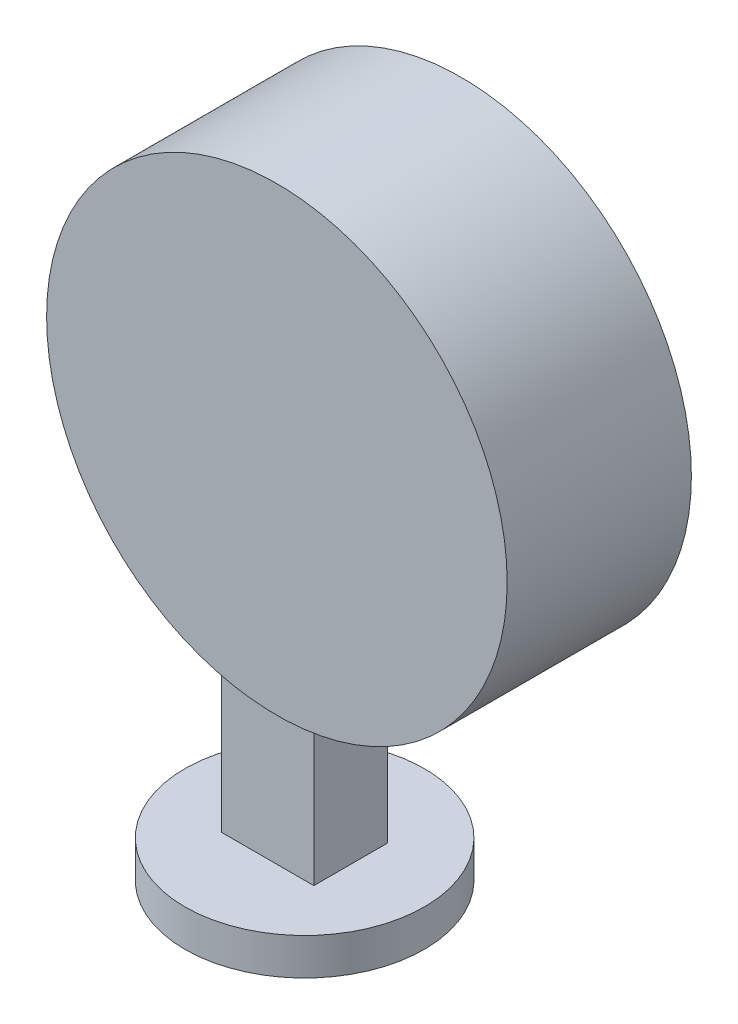
from build123d import *

# Parameters (mm, degrees)
SKETCH1_R                = 6.5
BOSS_EXTRUDE1_DEPTH      = 2
BOSS_EXTRUDE2_DEPTH      = 2
BOSS_EXTRUDE2_DEPTH_BACK = 2
BOSS_EXTRUDE3_DEPTH      = 5
BOSS_EXTRUDE3_DEPTH_BACK = 5
SKETCH3_R                = 12.5


with BuildPart() as part:
    # Sketch1 → Boss-Extrude1 (new body)
    with BuildSketch(Plane(origin=(0, 0, 0), x_dir=(1, 0, 0), z_dir=(0, 1, 0))):
        Circle(SKETCH1_R)
    extrude(amount=BOSS_EXTRUDE1_DEPTH)

    # Sketch2 → Boss-Extrude2 (add, two sides: drawn at the far end of the back side and taken through both)
    with BuildSketch(Plane.XY.offset(-BOSS_EXTRUDE2_DEPTH_BACK)):
        with BuildLine():
            Line((-2.5, 2), (-2.5, 21.005808669))
            ThreePointArc((-2.5, 21.005808669), (-0.744342007, 25.244342007), (3.494191331, 27))
            ThreePointArc((3.494191331, 27), (5.994191331, 24.5), (3.494191331, 22))
            ThreePointArc((3.494191331, 22), (2.791191899, 21.708808101), (2.5, 21.005808669))
            Line((2.5, 21.005808669), (2.5, 2))
            Line((2.5, 2), (-2.5, 2))
        make_face()
    extrude(amount=BOSS_EXTRUDE2_DEPTH + BOSS_EXTRUDE2_DEPTH_BACK)

    # Sketch3 → Boss-Extrude3 (add, two sides: drawn at the far end of the back side and taken through both)
    with BuildSketch(Plane.XY.offset(-BOSS_EXTRUDE3_DEPTH_BACK)):
        with Locations((3.494191331, 24.5)):
            Circle(SKETCH3_R)
    extrude(amount=BOSS_EXTRUDE3_DEPTH + BOSS_EXTRUDE3_DEPTH_BACK)


solid = part.part
